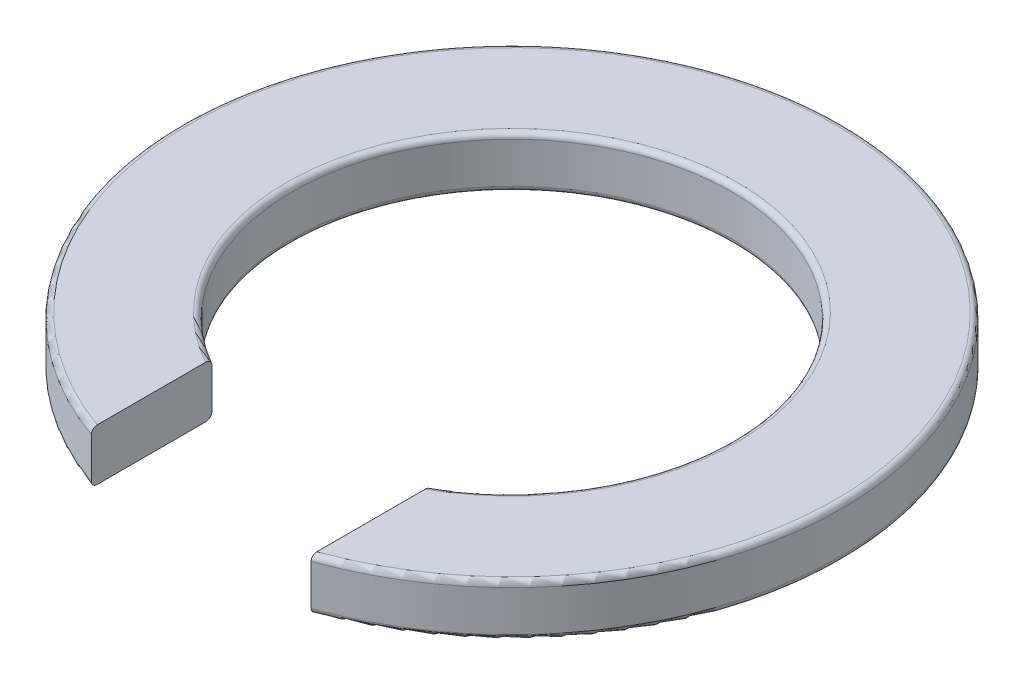
from build123d import *

# Parameters (mm, degrees)
SKETCH1_R           = 30
SKETCH1_R_2         = 20
BOSS_EXTRUDE1_DEPTH = 4.7
FILLET1_R           = 0.5
SKETCH2_W           = 20
SKETCH2_H           = 12.679491924
CUT_EXTRUDE1_DEPTH  = 43.685946165


with BuildPart() as part:
    # Sketch1 → Boss-Extrude1 (new body)
    with BuildSketch(Plane(origin=(0, 0, 0), x_dir=(1, 0, 0), z_dir=(0, 1, 0))):
        with Locations(Location((0, 0, 0), (0, 0, 270))):
            Circle(SKETCH1_R)
        with Locations(Location((0, 0, 0), (0, 0, 270))):
            Circle(SKETCH1_R_2, mode=Mode.SUBTRACT)
    extrude(amount=BOSS_EXTRUDE1_DEPTH)

    # Fillet1
    fillet1_edges = [part.edges().sort_by_distance(p)[0] for p in [
        (0, 0, -30),
        (0, 4.7, -30),
        (0, 0, -20),
        (0, 4.7, -20),
    ]]
    fillet(fillet1_edges, radius=FILLET1_R)

    # Sketch2 → Cut-Extrude1 (cut, through all)
    with BuildSketch(Plane(origin=(0, 4.7, 0), x_dir=(1, 0, 0), z_dir=(0, 1, 0))):
        with Locations((0, -23.660254038)):
            Rectangle(SKETCH2_W, SKETCH2_H)
    extrude(amount=-CUT_EXTRUDE1_DEPTH, mode=Mode.SUBTRACT)


solid = part.part
